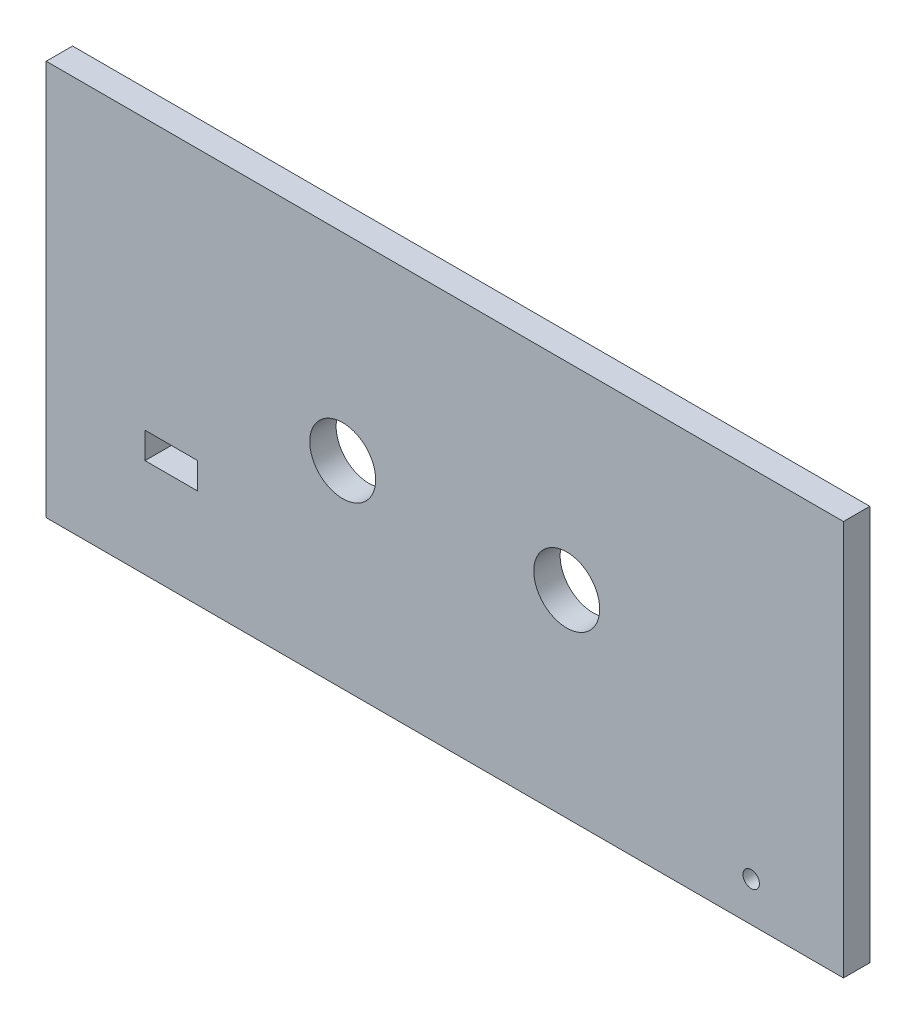
from build123d import *

# Parameters (mm, degrees)
SKETCH1_W           = 121
SKETCH1_H           = 60
SKETCH1_R           = 5
SKETCH1_R_2         = 1.25
SKETCH1_W_2         = 8
SKETCH1_H_2         = 4
BOSS_EXTRUDE1_DEPTH = 4


with BuildPart() as part:
    # Sketch1 → Boss-Extrude1 (new body)
    with BuildSketch(Plane.XY):
        with Locations((-18.5, 11.603893248)):
            Rectangle(SKETCH1_W, SKETCH1_H)
        with Locations((-34, 11.603893248)):
            Circle(SKETCH1_R, mode=Mode.SUBTRACT)
        with Locations((0, 11.603893248)):
            Circle(SKETCH1_R, mode=Mode.SUBTRACT)
        with Locations((28, -12.396106752)):
            Circle(SKETCH1_R_2, mode=Mode.SUBTRACT)
        with Locations((-60, -1.396106752)):
            Rectangle(SKETCH1_W_2, SKETCH1_H_2, mode=Mode.SUBTRACT)
    extrude(amount=BOSS_EXTRUDE1_DEPTH)


solid = part.part
